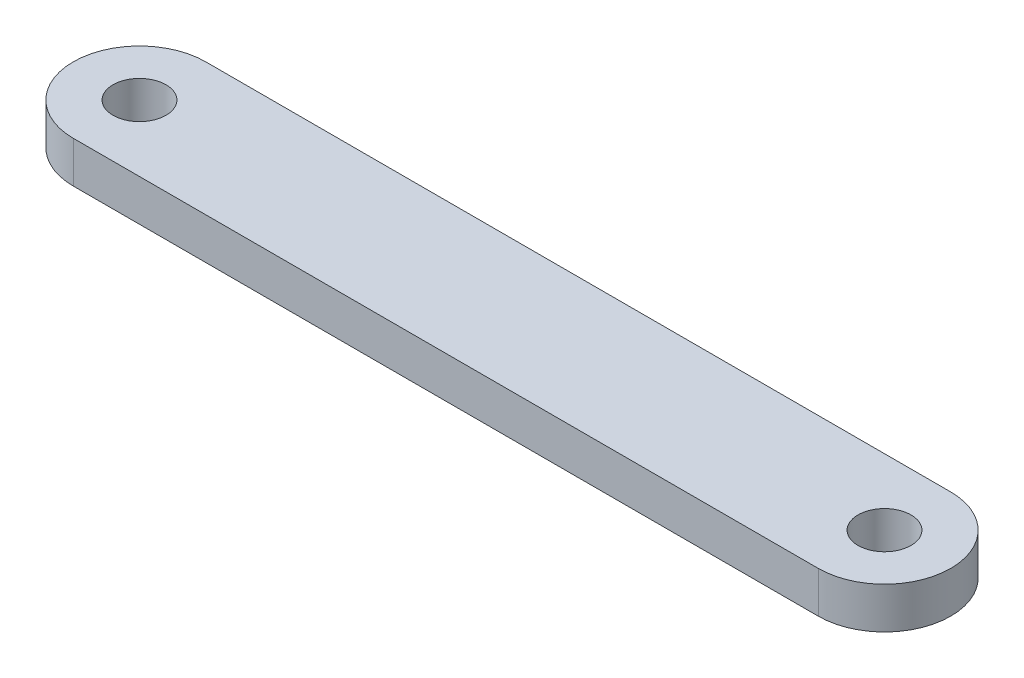
from build123d import *

# Parameters (mm, degrees)
SKETCH1_R           = 2.032
BOSS_EXTRUDE1_DEPTH = 3.175


with BuildPart() as part:
    # Sketch1 → Boss-Extrude1 (new body)
    with BuildSketch(Plane(origin=(0, 0, 0), x_dir=(1, 0, 0), z_dir=(0, 1, 0))):
        with BuildLine():
            Line((0, -5.08), (-57.15, -5.08))
            ThreePointArc((-57.15, -5.08), (-62.23, 0), (-57.15, 5.08))
            Line((-57.15, 5.08), (0, 5.08))
            ThreePointArc((0, 5.08), (5.08, 0), (0, -5.08))
        make_face()
        with Locations(Location((-57.15, 0, 0), (0, 0, 270))):
            Circle(SKETCH1_R, mode=Mode.SUBTRACT)
        with Locations(Location((0, 0, 0), (0, 0, 270))):
            Circle(SKETCH1_R, mode=Mode.SUBTRACT)
    extrude(amount=BOSS_EXTRUDE1_DEPTH)


solid = part.part
